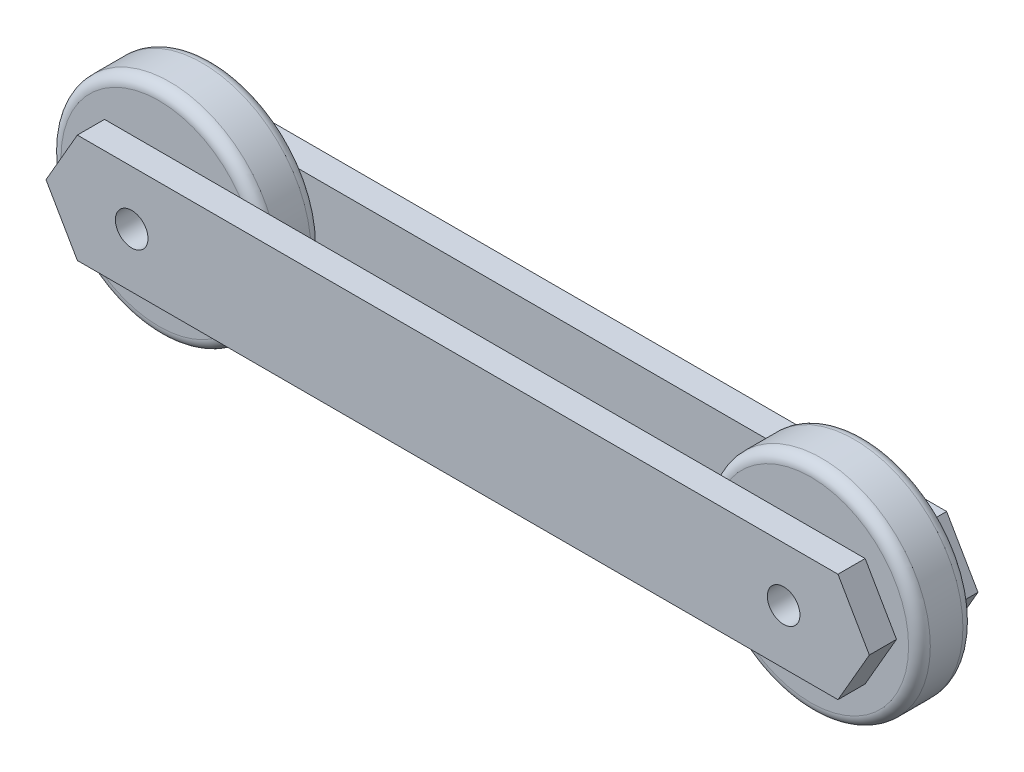
from build123d import *

# Parameters (mm, degrees)
SKETCH1_R             = 15
BOSS_EXTRUDE1_DEPTH   = 12.5
SKETCH2_R             = 40
BOSS_EXTRUDE2_DEPTH   = 50
SKETCH3_R             = 100
BOSS_EXTRUDE3_DEPTH   = 25
BOSS_EXTRUDE3_2_DEPTH = 25
FILLET1_R             = 10
FILLET2_R             = 10


with BuildPart() as part:
    # Sketch1 → Boss-Extrude1 (new, symmetric)
    with BuildSketch(Plane.XY):
        Polygon((28.867513459, 50), (0, 100), (-700, 100), (-728.867513459, 50), (-700, 0), (0, 0), align=None)
        with Locations((-650, 50)):
            Circle(SKETCH1_R, mode=Mode.SUBTRACT)
        with Locations((-50, 50)):
            Circle(SKETCH1_R, mode=Mode.SUBTRACT)
    extrude(amount=BOSS_EXTRUDE1_DEPTH, both=True)


with BuildPart() as body_2:
    # Mirror6: mirrored copy
    add(part.part.mirror(Plane(origin=(0, 0, -37.5), x_dir=(1, 0, 0), z_dir=(0, 0, -1))))


with BuildPart() as part_1:
    add(part.part)

    add(body_2.part)  # Boss-Extrude2 merges body 2
    # Sketch2 → Boss-Extrude2 (add)
    with BuildSketch(Plane.XY.offset(-62.5)):
        with Locations(Location((-650, 50, 0), (0, 0, 180))):
            Circle(SKETCH2_R)
        with Locations(Location((-50, 50, 0), (0, 0, 180))):
            Circle(SKETCH2_R)
    extrude(amount=BOSS_EXTRUDE2_DEPTH)


with BuildPart() as body_2_2:
    # Sketch3 → Boss-Extrude3 (new, symmetric)
    with BuildSketch(Plane(origin=(0, 0, -37.5), x_dir=(-1, 0, 0), z_dir=(0, 0, -1))):
        with Locations((50, 50)):
            Circle(SKETCH3_R)
    extrude(amount=BOSS_EXTRUDE3_DEPTH, both=True)

    # Fillet1
    fillet1_edges = [body_2_2.edges().sort_by_distance(p)[0] for p in [
        (50, 50, -12.5),
        (50, 50, -62.5),
    ]]
    fillet(fillet1_edges, radius=FILLET1_R)


with BuildPart() as body_3:
    # Sketch3 → Boss-Extrude3 2 (new, symmetric)
    with BuildSketch(Plane(origin=(0, 0, -37.5), x_dir=(-1, 0, 0), z_dir=(0, 0, -1))):
        with Locations((650, 50)):
            Circle(SKETCH3_R)
    extrude(amount=BOSS_EXTRUDE3_2_DEPTH, both=True)

    # Fillet2
    fillet2_edges = [body_3.edges().sort_by_distance(p)[0] for p in [
        (-550, 50, -12.5),
        (-550, 50, -62.5),
    ]]
    fillet(fillet2_edges, radius=FILLET2_R)


solid = Compound([part_1.part, body_2_2.part, body_3.part])
